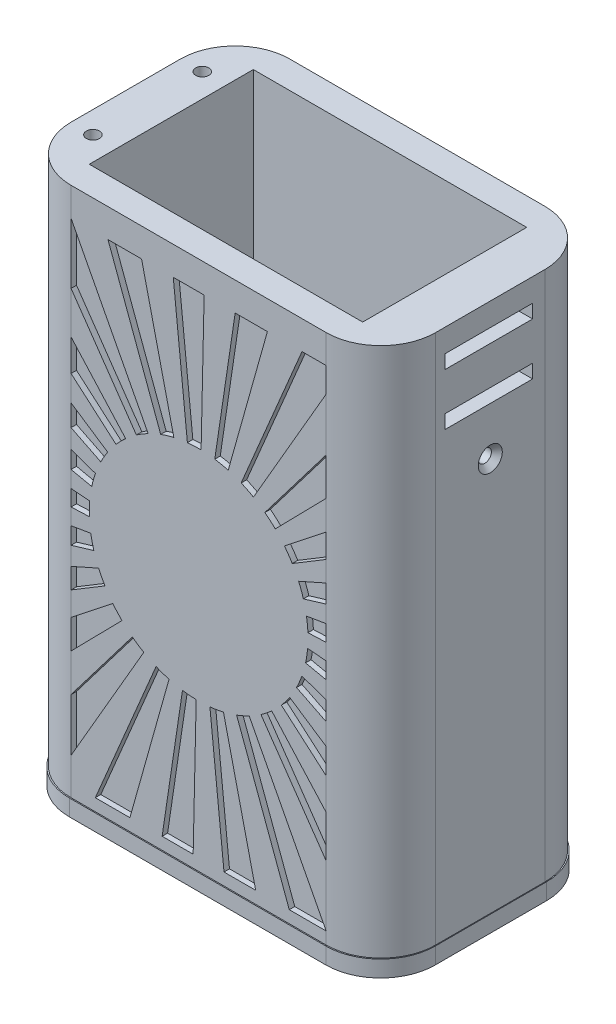
from build123d import *

# Parameters (mm, degrees)
SKETCH4_W                                           = 50
SKETCH4_H                                           = 30
BOSS_EXTRUDE1_DEPTH                                 = 100
CSK_FOR_M2_COUNTERSUNK_FLAT_HEAD_SCREW1_D           = 2.4
CSK_FOR_M2_COUNTERSUNK_FLAT_HEAD_SCREW1_DEPTH       = 20
CSK_FOR_M2_COUNTERSUNK_FLAT_HEAD_SCREW1_CSINK_D     = 4.4
CSK_FOR_M2_COUNTERSUNK_FLAT_HEAD_SCREW1_CSINK_ANGLE = 90
CSK_FOR_M2_COUNTERSUNK_FLAT_HEAD_SCREW1_TIP         = 0.721032743
CUT_EXTRUDE3_DEPTH                                  = 1
M2_CLEARANCE_HOLE1_D                                = 2.4
M2_CLEARANCE_HOLE1_DEPTH                            = 10
M2_CLEARANCE_HOLE1_TIP                              = 0.721032743
SKETCH9_W                                           = 16
SKETCH9_H                                           = 2.5
CUT_EXTRUDE4_DEPTH                                  = 10
BOSS_EXTRUDE2_DEPTH                                 = 3
SKETCH14_W                                          = 14
SKETCH14_H                                          = 9
CUT_EXTRUDE5_DEPTH                                  = 3


with BuildPart() as part:
    # Sketch4 → Boss-Extrude1 (new body)
    with BuildSketch(Plane(origin=(0, 0, 0), x_dir=(1, 0, 0), z_dir=(0, 1, 0))):
        with BuildLine():
            Line((23.333333333, 20), (-23.333333333, 20))
            ThreePointArc((-23.333333333, 20), (-30.404401145, 17.071067812), (-33.333333333, 10))
            Line((-33.333333333, 10), (-33.333333333, -10))
            ThreePointArc((-33.333333333, -10), (-30.404401145, -17.071067812), (-23.333333333, -20))
            Line((-23.333333333, -20), (23.333333333, -20))
            ThreePointArc((23.333333333, -20), (30.404401145, -17.071067812), (33.333333333, -10))
            Line((33.333333333, -10), (33.333333333, 10))
            ThreePointArc((33.333333333, 10), (30.404401145, 17.071067812), (23.333333333, 20))
        make_face()
        Rectangle(SKETCH4_W, SKETCH4_H, mode=Mode.SUBTRACT)
    extrude(amount=BOSS_EXTRUDE1_DEPTH)

    # CSK for M2 Countersunk Flat Head Screw1
    with Locations(Plane(origin=(33.333333333, 0, 0), x_dir=(0, 0, -1), z_dir=(1, 0, 0))):
        with Locations((0, 75)):
            CounterSinkHole(CSK_FOR_M2_COUNTERSUNK_FLAT_HEAD_SCREW1_D / 2, CSK_FOR_M2_COUNTERSUNK_FLAT_HEAD_SCREW1_CSINK_D / 2, depth=CSK_FOR_M2_COUNTERSUNK_FLAT_HEAD_SCREW1_DEPTH, counter_sink_angle=CSK_FOR_M2_COUNTERSUNK_FLAT_HEAD_SCREW1_CSINK_ANGLE)
            with Locations((0, 0, -(CSK_FOR_M2_COUNTERSUNK_FLAT_HEAD_SCREW1_DEPTH + CSK_FOR_M2_COUNTERSUNK_FLAT_HEAD_SCREW1_TIP / 2))):  # 118° drill point
                Cone(0, CSK_FOR_M2_COUNTERSUNK_FLAT_HEAD_SCREW1_D / 2, CSK_FOR_M2_COUNTERSUNK_FLAT_HEAD_SCREW1_TIP, mode=Mode.SUBTRACT)

    # Sketch6 → Cut-Extrude3 (cut)
    with BuildSketch(Plane.XY.offset(20)):
        with BuildLine():
            Line((-9.233484388, 67.72041761), (-23.333333333, 94.780106135))
            Line((-23.333333333, 94.780106135), (-23.333333333, 83.667555351))
            Line((-23.333333333, 83.667555351), (-11.383175953, 66.423763655))
            ThreePointArc((-11.383175953, 66.423763655), (-10.328695354, 67.105853584), (-9.233484388, 67.72041761))
        make_face()
        with BuildLine():
            Line((-10.436724911, 94.780106135), (-16.583372209, 94.780106135))
            Line((-16.583372209, 94.780106135), (-6.938339696, 68.737532001))
            ThreePointArc((-6.938339696, 68.737532001), (-5.74744889, 69.136081118), (-4.53389293, 69.459104711))
            Line((-4.53389293, 69.459104711), (-10.436724911, 94.780106135))
        make_face()
        with BuildLine():
            Line((-13.353546269, 64.867970833), (-23.333333333, 75.981869304))
            Line((-23.333333333, 75.981869304), (-23.333333333, 70.19209572))
            Line((-23.333333333, 70.19209572), (-15.11354215, 63.07751973))
            ThreePointArc((-15.11354215, 63.07751973), (-14.26166677, 64.000389483), (-13.353546269, 64.867970833))
        make_face()
        with BuildLine():
            Line((1.003508575, 94.780106135), (-4.641683782, 94.780106135))
            Line((-4.641683782, 94.780106135), (-2.058010763, 69.873782163))
            ThreePointArc((-2.058010763, 69.873782163), (-0.805436432, 69.963803521), (0.450318366, 69.975036732))
            Line((0.450318366, 69.975036732), (1.003508575, 94.780106135))
        make_face()
        with BuildLine():
            Line((-16.635413762, 61.080588211), (-23.333333333, 65.543757932))
            Line((-23.333333333, 65.543757932), (-23.333333333, 61.617330353))
            Line((-23.333333333, 61.617330353), (-17.895151858, 58.908610717))
            ThreePointArc((-17.895151858, 58.908610717), (-17.299401046, 60.014387902), (-16.635413762, 61.080588211))
        make_face()
        with BuildLine():
            Line((12.57581288, 94.780106135), (6.68067327, 94.780106135))
            Line((6.68067327, 94.780106135), (2.951595508, 69.761268935))
            ThreePointArc((2.951595508, 69.761268935), (4.187265314, 69.537105817), (5.406430418, 69.235832816))
            Line((5.406430418, 69.235832816), (12.57581288, 94.780106135))
        make_face()
        with BuildLine():
            Line((-18.872866948, 56.595786195), (-23.333333333, 58.155859256))
            Line((-23.333333333, 58.155859256), (-23.333333333, 54.987405281))
            Line((-23.333333333, 54.987405281), (-19.553104384, 54.178542177))
            ThreePointArc((-19.553104384, 54.178542177), (-19.25096076, 55.39785077), (-18.872866948, 56.595786195))
        make_face()
        with BuildLine():
            Line((23.333333333, 94.780106135), (18.904437375, 94.780106135))
            Line((18.904437375, 94.780106135), (7.776159231, 68.406984135))
            ThreePointArc((7.776159231, 68.406984135), (8.917384462, 67.882665417), (10.023451045, 67.287752094))
            Line((10.023451045, 67.287752094), (23.333333333, 90.269234655))
            Line((23.333333333, 90.269234655), (23.333333333, 94.780106135))
        make_face()
        with BuildLine():
            Line((-19.925090323, 51.694963257), (-23.333333333, 51.98580874))
            Line((-23.333333333, 51.98580874), (-23.333333333, 49.048311907))
            Line((-23.333333333, 49.048311907), (-19.982904528, 49.184192785))
            ThreePointArc((-19.982904528, 49.184192785), (-19.993446588, 50.440486397), (-19.925090323, 51.694963257))
        make_face()
        with BuildLine():
            Line((23.333333333, 73.74617797), (23.333333333, 80.636636151))
            Line((23.333333333, 80.636636151), (12.112894069, 65.895736511))
            ThreePointArc((12.112894069, 65.895736511), (13.088029688, 65.104108892), (14.011552246, 64.252833469))
            Line((14.011552246, 64.252833469), (23.333333333, 73.74617797))
        make_face()
        with BuildLine():
            Line((-19.725577111, 46.685817077), (-23.333333333, 46.080633734))
            Line((-23.333333333, 46.080633734), (-23.333333333, 42.984531678))
            Line((-23.333333333, 42.984531678), (-19.157107487, 44.239241744))
            ThreePointArc((-19.157107487, 44.239241744), (-19.479787646, 45.453596511), (-19.725577111, 46.685817077))
        make_face()
        with BuildLine():
            Line((23.333333333, 64.072630101), (23.333333333, 68.426502566))
            Line((23.333333333, 68.426502566), (15.689483687, 62.384893577))
            ThreePointArc((15.689483687, 62.384893577), (16.43726599, 61.375581822), (17.1202128, 60.321317983))
            Line((17.1202128, 60.321317983), (23.333333333, 64.072630101))
        make_face()
        with BuildLine():
            Line((-18.286404986, 41.883069947), (-23.333333333, 39.64421499))
            Line((-23.333333333, 39.64421499), (-23.333333333, 35.907369899))
            Line((-23.333333333, 35.907369899), (-17.12715186, 39.654492402))
            ThreePointArc((-17.12715186, 39.654492402), (-17.74180244, 40.750562513), (-18.286404986, 41.883069947))
        make_face()
        with BuildLine():
            Line((23.333333333, 56.995468322), (23.333333333, 60.33578501))
            Line((23.333333333, 60.33578501), (18.281148679, 58.094598316))
            ThreePointArc((18.281148679, 58.094598316), (18.754542831, 56.930915708), (19.153943102, 55.739807545))
            Line((19.153943102, 55.739807545), (23.333333333, 56.995468322))
        make_face()
        with BuildLine():
            Line((-15.697590599, 37.588698816), (-23.333333333, 31.553497434))
            Line((-23.333333333, 31.553497434), (-23.333333333, 26.23382203))
            Line((-23.333333333, 26.23382203), (-14.020238726, 35.71832018))
            ThreePointArc((-14.020238726, 35.71832018), (-14.888312541, 36.627145538), (-15.697590599, 37.588698816))
        make_face()
        with BuildLine():
            Line((23.333333333, 50.931688093), (23.333333333, 53.899366266))
            Line((23.333333333, 53.899366266), (19.724782373, 53.294049609))
            ThreePointArc((19.724782373, 53.294049609), (19.893949888, 52.049045685), (19.984608269, 50.795876312))
            Line((19.984608269, 50.795876312), (23.333333333, 50.931688093))
        make_face()
        with BuildLine():
            Line((-12.121535418, 34.07291088), (-23.333333333, 19.343363849))
            Line((-23.333333333, 19.343363849), (-23.333333333, 9.710765345))
            Line((-23.333333333, 9.710765345), (-10.0314254, 32.678479001))
            ThreePointArc((-10.0314254, 32.678479001), (-11.098399586, 33.342840347), (-12.121535418, 34.07291088))
        make_face()
        with BuildLine():
            Line((23.333333333, 44.992594719), (23.333333333, 47.99419126))
            Line((23.333333333, 47.99419126), (19.929264387, 48.284680546))
            ThreePointArc((19.929264387, 48.284680546), (19.783461097, 47.036568032), (19.559565394, 45.800075348))
            Line((19.559565394, 45.800075348), (23.333333333, 44.992594719))
        make_face()
        with BuildLine():
            Line((-7.782886639, 31.557072451), (-18.89599827, 5.219893865))
            Line((-18.89599827, 5.219893865), (-12.570199581, 5.219893865))
            Line((-12.570199581, 5.219893865), (-5.411409276, 30.72642768))
            ThreePointArc((-5.411409276, 30.72642768), (-6.610205831, 31.104470049), (-7.782886639, 31.557072451))
        make_face()
        with BuildLine():
            Line((23.333333333, 38.362669647), (23.333333333, 41.824140744))
            Line((23.333333333, 41.824140744), (18.88128783, 43.381268554))
            ThreePointArc((18.88128783, 43.381268554), (18.429567389, 42.208512664), (17.905082394, 41.066442954))
            Line((17.905082394, 41.066442954), (23.333333333, 38.362669647))
        make_face()
        with BuildLine():
            Line((-2.954434079, 30.199686745), (-6.677692254, 5.219893865))
            Line((-6.677692254, 5.219893865), (-1.003062545, 5.219893865))
            Line((-1.003062545, 5.219893865), (-0.450759398, 29.985187393))
            ThreePointArc((-0.450759398, 29.985187393), (-1.705968843, 30.053077261), (-2.954434079, 30.199686745))
        make_face()
        with BuildLine():
            Line((23.333333333, 29.78790428), (23.333333333, 34.436242068))
            Line((23.333333333, 34.436242068), (16.646308873, 38.892151813))
            ThreePointArc((16.646308873, 38.892151813), (15.916980552, 37.868529527), (15.124796154, 36.892739455))
            Line((15.124796154, 36.892739455), (23.333333333, 29.78790428))
        make_face()
        with BuildLine():
            Line((2.060073878, 30.086329635), (4.63960907, 5.219893865))
            Line((4.63960907, 5.219893865), (10.432062511, 5.219893865))
            Line((10.432062511, 5.219893865), (4.538409454, 30.501521044))
            ThreePointArc((4.538409454, 30.501521044), (3.305768883, 30.254963467), (2.060073878, 30.086329635))
        make_face()
        with BuildLine():
            Line((23.333333333, 16.312444649), (23.333333333, 23.998130696))
            Line((23.333333333, 23.998130696), (13.36453093, 35.0997962))
            ThreePointArc((13.36453093, 35.0997962), (12.403399181, 34.289738565), (11.39327996, 33.541656504))
            Line((11.39327996, 33.541656504), (23.333333333, 16.312444649))
        make_face()
        with BuildLine():
            Line((6.945104735, 31.224201702), (16.575965083, 5.219893865))
            Line((16.575965083, 5.219893865), (23.322912039, 5.219893865))
            Line((23.322912039, 5.219893865), (9.242151765, 32.242948416))
            ThreePointArc((9.242151765, 32.242948416), (8.109643618, 31.69746397), (6.945104735, 31.224201702))
        make_face()
    cut_extrude3 = extrude(amount=-CUT_EXTRUDE3_DEPTH, mode=Mode.SUBTRACT)

    # Mirror1: Cut-Extrude3 across plane
    add(cut_extrude3.mirror(Plane.XY), mode=Mode.SUBTRACT)

    # M2 Clearance Hole1
    with Locations(Plane(origin=(0, 100, 0), x_dir=(1, 0, 0), z_dir=(0, 1, 0))):
        with Locations((-29.333333333, -10), (-29.333333333, 10)):
            Hole(M2_CLEARANCE_HOLE1_D / 2, depth=M2_CLEARANCE_HOLE1_DEPTH)
            with Locations((0, 0, -(M2_CLEARANCE_HOLE1_DEPTH + M2_CLEARANCE_HOLE1_TIP / 2))):  # 118° drill point
                Cone(0, M2_CLEARANCE_HOLE1_D / 2, M2_CLEARANCE_HOLE1_TIP, mode=Mode.SUBTRACT)

    # Sketch9 → Cut-Extrude4 (cut)
    with BuildSketch(Plane(origin=(33.333333333, 0, 0), x_dir=(0, 0, -1), z_dir=(1, 0, 0))):
        with Locations((-0.256006046, 94.535351761)):
            Rectangle(SKETCH9_W, SKETCH9_H)
        with Locations((-0.256006046, 85.035351761)):
            Rectangle(SKETCH9_W, SKETCH9_H)
    extrude(amount=-CUT_EXTRUDE4_DEPTH, mode=Mode.SUBTRACT)

    # Sketch13 → Boss-Extrude2 (add)
    with BuildSketch(Plane(origin=(0, 0, 0), x_dir=(-1, 0, 0), z_dir=(0, -1, 0))):
        with BuildLine():
            Line((23.463740645, 20.191003193), (-23.463740645, 20.191003193))
            ThreePointArc((-23.463740645, 20.191003193), (-30.534808457, 17.262071005), (-33.463740645, 10.191003193))
            Line((-33.463740645, 10.191003193), (-33.463740645, -10.191003193))
            ThreePointArc((-33.463740645, -10.191003193), (-30.534808457, -17.262071005), (-23.463740645, -20.191003193))
            Line((-23.463740645, -20.191003193), (23.463740645, -20.191003193))
            ThreePointArc((23.463740645, -20.191003193), (30.534808457, -17.262071005), (33.463740645, -10.191003193))
            Line((33.463740645, -10.191003193), (33.463740645, 10.191003193))
            ThreePointArc((33.463740645, 10.191003193), (30.534808457, 17.262071005), (23.463740645, 20.191003193))
        make_face()
    extrude(amount=-BOSS_EXTRUDE2_DEPTH)

    # Sketch14 → Cut-Extrude5 (cut)
    with BuildSketch(Plane.XZ):
        Rectangle(SKETCH14_W, SKETCH14_H)
    extrude(amount=-CUT_EXTRUDE5_DEPTH, mode=Mode.SUBTRACT)


solid = part.part
